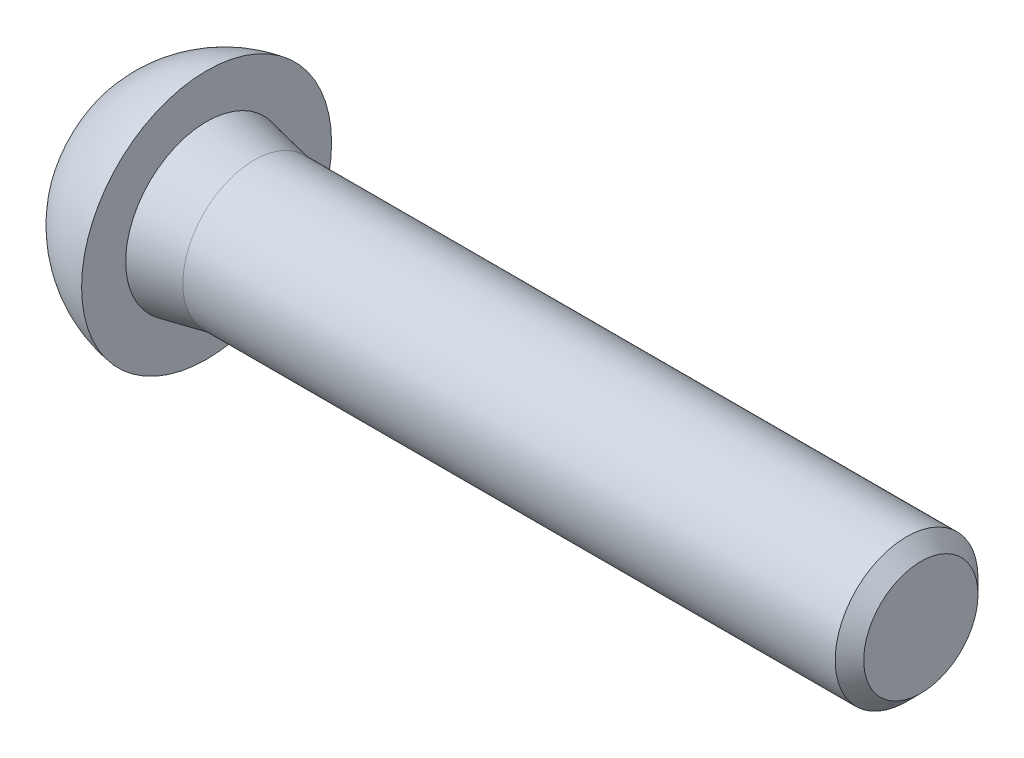
from build123d import *

# Parameters (mm, degrees)
CUT_EXTRUDE_1_DEPTH = 2.08
CHAMFER_1_SIZE      = 0.6


with BuildPart() as part:
    # 草图1 → 旋转1 (revolve)
    with BuildSketch(Plane.XY, mode=Mode.PRIVATE) as revolve_1_sk:
        with BuildLine():
            Line((0, 0), (0, 3))
            Line((0, 3), (-28, 3))
            Line((-28, 3), (-30, 3.4))
            Line((-30, 3.4), (-30, 5.25))
            ThreePointArc((-30, 5.25), (-31.818247324, 4.638396814), (-33.3, 3.42))
            Line((-33.3, 3.42), (-33.3, 0))
            Line((-33.3, 0), (0, 0))
        make_face()
    revolve(revolve_1_sk.sketch.rotate(Axis((0, 0, 0), (-1, 0, 0)), 90), axis=Axis((0, 0, 0), (-1, 0, 0)))

    # 草图4 → 切除-拉伸1 (cut)
    with BuildSketch(Plane.ZY.offset(33.3)):
        Polygon((0, 2.309401077), (-2, 1.154700538), (-2, -1.154700538), (0, -2.309401077), (2, -1.154700538), (2, 1.154700538), align=None)
    extrude(amount=-CUT_EXTRUDE_1_DEPTH, mode=Mode.SUBTRACT)

    # 倒角1
    chamfer_1_edges = [part.edges().sort_by_distance(p)[0] for p in [
        (0, 0, 3),
    ]]
    chamfer(chamfer_1_edges, length=CHAMFER_1_SIZE)

    # 草图6 → 切除-放样1 section 0
    with BuildSketch(Plane.ZY.offset(31.22), mode=Mode.PRIVATE) as loft_1_s0:
        with BuildLine():
            Line((0, 2.309401077), (-2, 1.154700538))
            Line((-2, 1.154700538), (-2, -1.154700538))
            Line((-2, -1.154700538), (0, -2.309401077))
            Line((0, -2.309401077), (2, -1.154700538))
            Line((2, -1.154700538), (2, 1.154700538))
            Line((2, 1.154700538), (0, 2.309401077))
        make_face()
    loft([Vertex(-30.8075, 0, 0), loft_1_s0.sketch], mode=Mode.SUBTRACT)


solid = part.part
